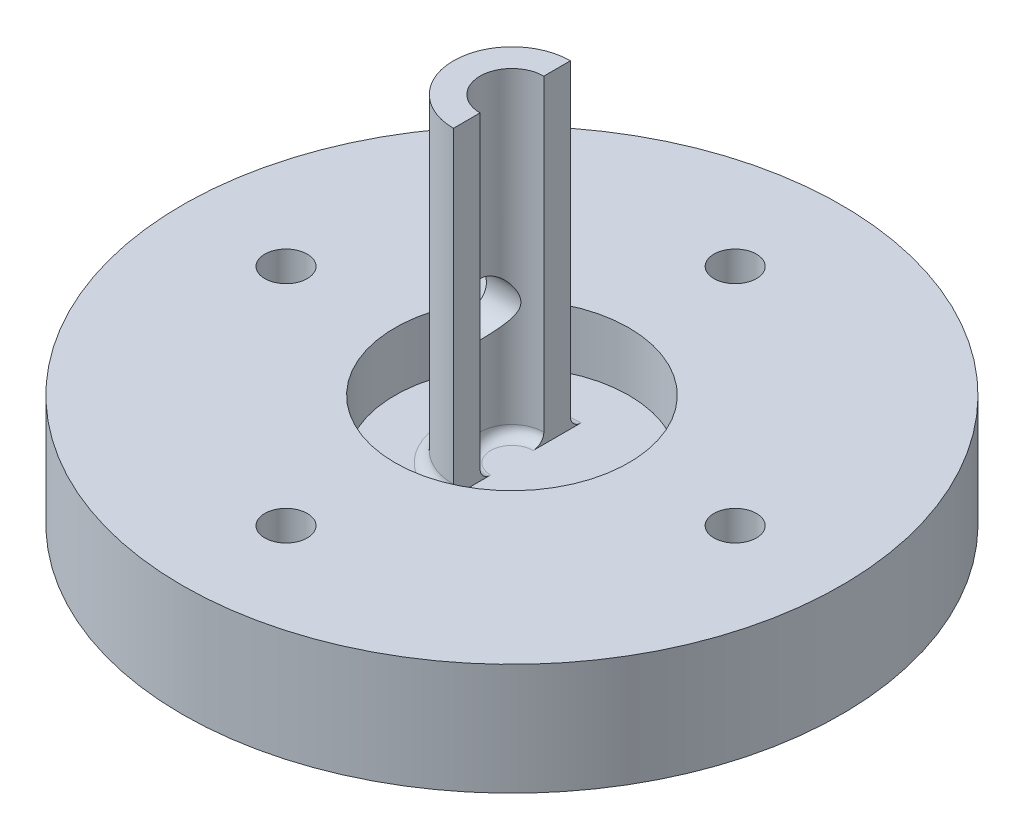
from build123d import *

# Parameters (mm, degrees)
BOSS_EXTRUDE2_DEPTH     = 30
SKETCH2_R               = 31
BOSS_EXTRUDE3_DEPTH     = 5
FILLET1_R               = 1
BOSS_EXTRUDE4_START     = 5.5
SKETCH3_R               = 31
SKETCH3_R_2             = 11
BOSS_EXTRUDE4_DEPTH     = 5.5
CUT_EXTRUDE1_DEPTH      = 51.222007128
CUT_EXTRUDE1_DEPTH_BACK = 51.222007128
SKETCH4_R               = 2
CUT_EXTRUDE2_DEPTH      = 54.122499941
CUT_EXTRUDE2_DEPTH_BACK = 54.122499941
SKETCH6_R               = 2.5
FILLET2_R               = 1


with BuildPart() as part:
    # Sketch1 → Boss-Extrude2 (new body)
    with BuildSketch(Plane(origin=(0, 0, 0), x_dir=(1, 0, 0), z_dir=(0, 1, 0))):
        with BuildLine():
            Line((0, 5.5), (0, 3))
            ThreePointArc((0, 3), (-3, 0), (0, -3))
            Line((0, -3), (0, -5.5))
            ThreePointArc((0, -5.5), (-5.5, 0), (0, 5.5))
        make_face()
    extrude(amount=BOSS_EXTRUDE2_DEPTH)

    # Sketch2 → Boss-Extrude3 (add)
    with BuildSketch(Plane(origin=(0, 0, 0), x_dir=(1, 0, 0), z_dir=(0, 1, 0))):
        with Locations(Location((0, 0, 0), (0, 0, 270))):
            Circle(SKETCH2_R)
    extrude(amount=-BOSS_EXTRUDE3_DEPTH)

    # Fillet1
    fillet1_edges = [part.edges().sort_by_distance(p)[0] for p in [
        (-5.5, 0, 0),
    ]]
    fillet(fillet1_edges, radius=FILLET1_R)

    # Sketch3 → Boss-Extrude4 (add)
    with BuildSketch(Plane(origin=(0, 0, 0), x_dir=(1, 0, 0), z_dir=(0, 1, 0)).offset(BOSS_EXTRUDE4_START)):
        with Locations(Location((0, 0, 0), (0, 0, 270))):
            Circle(SKETCH3_R)
        with Locations(Location((0, 0, 0), (0, 0, 270))):
            Circle(SKETCH3_R_2, mode=Mode.SUBTRACT)
    extrude(amount=-BOSS_EXTRUDE4_DEPTH)

    # Sketch4 → Cut-Extrude1 (cut, two sides: drawn at the far end of the back side and taken through both)
    with BuildSketch(Plane(origin=(0, 5.5, 0), x_dir=(1, 0, 0), z_dir=(0, 1, 0)).offset(-CUT_EXTRUDE1_DEPTH_BACK)):
        with Locations(Location((0, 21, 0), (0, 0, 270))):
            Circle(SKETCH4_R)
        with Locations(Location((21.125, -0.125, 0), (0, 0, 270))):
            Circle(SKETCH4_R)
        with Locations(Location((0, -21.25, 0), (0, 0, 270))):
            Circle(SKETCH4_R)
        with Locations(Location((-21.125, -0.125, 0), (0, 0, 270))):
            Circle(SKETCH4_R)
    extrude(amount=CUT_EXTRUDE1_DEPTH + CUT_EXTRUDE1_DEPTH_BACK, mode=Mode.SUBTRACT)

    # Sketch6 → Cut-Extrude2 (cut, two sides: drawn at the far end of the back side and taken through both)
    with BuildSketch(Plane(origin=(0, 0, 0), x_dir=(0, 0, -1), z_dir=(1, 0, 0)).offset(-CUT_EXTRUDE2_DEPTH_BACK)):
        with Locations((0, 11)):
            Circle(SKETCH6_R)
    extrude(amount=CUT_EXTRUDE2_DEPTH + CUT_EXTRUDE2_DEPTH_BACK, mode=Mode.SUBTRACT)

    # Fillet2
    fillet2_edges = [part.edges().sort_by_distance(p)[0] for p in [
        (-3, 0, 0),
    ]]
    fillet(fillet2_edges, radius=FILLET2_R)


solid = part.part
